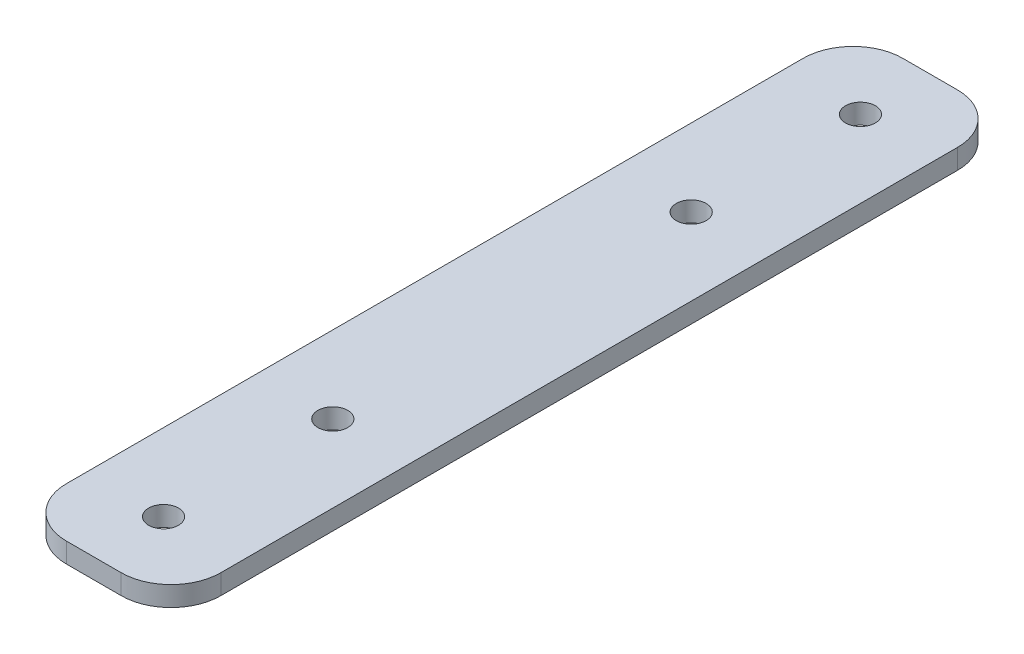
from build123d import *

# Parameters (mm, degrees)
ESQUISSE1_W             = 15.5
ESQUISSE1_H             = 2
EXTRU_MINCE1_DEPTH      = 84
ESQUISSE2_R             = 1.5
ENL_V_MAT_EXTRU_1_DEPTH = 86.441500455
CONG_1_R                = 5


with BuildPart() as part:
    # Esquisse1 → Extru.-Mince1 (new body)
    with BuildSketch(Plane.XY):
        with Locations((7.75, 1)):
            Rectangle(ESQUISSE1_W, ESQUISSE1_H)
    extrude(amount=EXTRU_MINCE1_DEPTH)

    # Esquisse2 → Enlèv. mat.-Extru.1 (cut, through all)
    with BuildSketch(Plane(origin=(0, 2, 0), x_dir=(1, 0, 0), z_dir=(0, 1, 0))):
        with Locations(Location((7.75, -24, 0), (0, 0, 270))):
            Circle(ESQUISSE2_R)
        with Locations(Location((7.75, -7, 0), (0, 0, 270))):
            Circle(ESQUISSE2_R)
        with Locations(Location((7.75, -77, 0), (0, 0, 90))):
            Circle(ESQUISSE2_R)
        with Locations(Location((7.75, -60, 0), (0, 0, 90))):
            Circle(ESQUISSE2_R)
    extrude(amount=-ENL_V_MAT_EXTRU_1_DEPTH, mode=Mode.SUBTRACT)

    # Congé1
    cong_1_edges = [part.edges().sort_by_distance(p)[0] for p in [
        (0, 1, 84),
        (0, 1, 0),
        (15.5, 1, 0),
        (15.5, 1, 84),
    ]]
    fillet(cong_1_edges, radius=CONG_1_R)


solid = part.part
